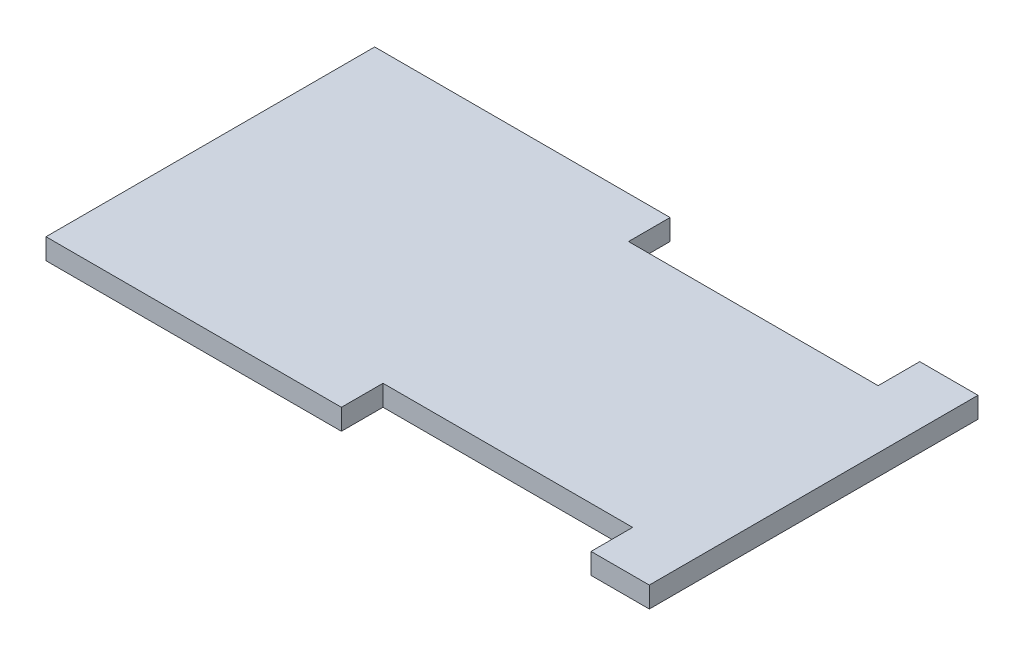
from build123d import *

# Parameters (mm, degrees)
ESQUISSE1_W      = 145
ESQUISSE1_H      = 79
EXTRUSION1_DEPTH = 5
EXTRUSION2_REACH = 108.696
ESQUISSE2_W      = 60
ESQUISSE2_H      = 10


with BuildPart() as part:
    # Esquisse1 → Extrusion1 (new body)
    with BuildSketch(Plane(origin=(0, 0, 0), x_dir=(1, 0, 0), z_dir=(0, 1, 0))):
        with Locations((24.232219602, -5.242282495)):
            Rectangle(ESQUISSE1_W, ESQUISSE1_H)
    extrude(amount=EXTRUSION1_DEPTH)

    # Esquisse2 → Extrusion2 (cut, up to next)
    with BuildSketch(Plane(origin=(0, 5, 0), x_dir=(1, 0, 0), z_dir=(0, 1, 0)), mode=Mode.PRIVATE) as extrusion2_sk1:
        with Locations((52.732219602, 29.257717505)):
            Rectangle(ESQUISSE2_W, ESQUISSE2_H)
    extrusion2_tool1 = extrude(extrusion2_sk1.sketch, amount=-EXTRUSION2_REACH, mode=Mode.PRIVATE) & part.part
    # Esquisse2 → Extrusion2 (cut, up to next)
    with BuildSketch(Plane(origin=(0, 5, 0), x_dir=(1, 0, 0), z_dir=(0, 1, 0)), mode=Mode.PRIVATE) as extrusion2_sk2:
        with Locations((52.732219602, -39.742282495)):
            Rectangle(ESQUISSE2_W, ESQUISSE2_H)
    extrusion2_tool2 = extrude(extrusion2_sk2.sketch, amount=-EXTRUSION2_REACH, mode=Mode.PRIVATE) & part.part
    add(extrusion2_tool1.solids().sort_by_distance((52.73222, 5, -29.257718))[0], mode=Mode.SUBTRACT)
    add(extrusion2_tool2.solids().sort_by_distance((52.73222, 5, 39.742282))[0], mode=Mode.SUBTRACT)


solid = part.part
